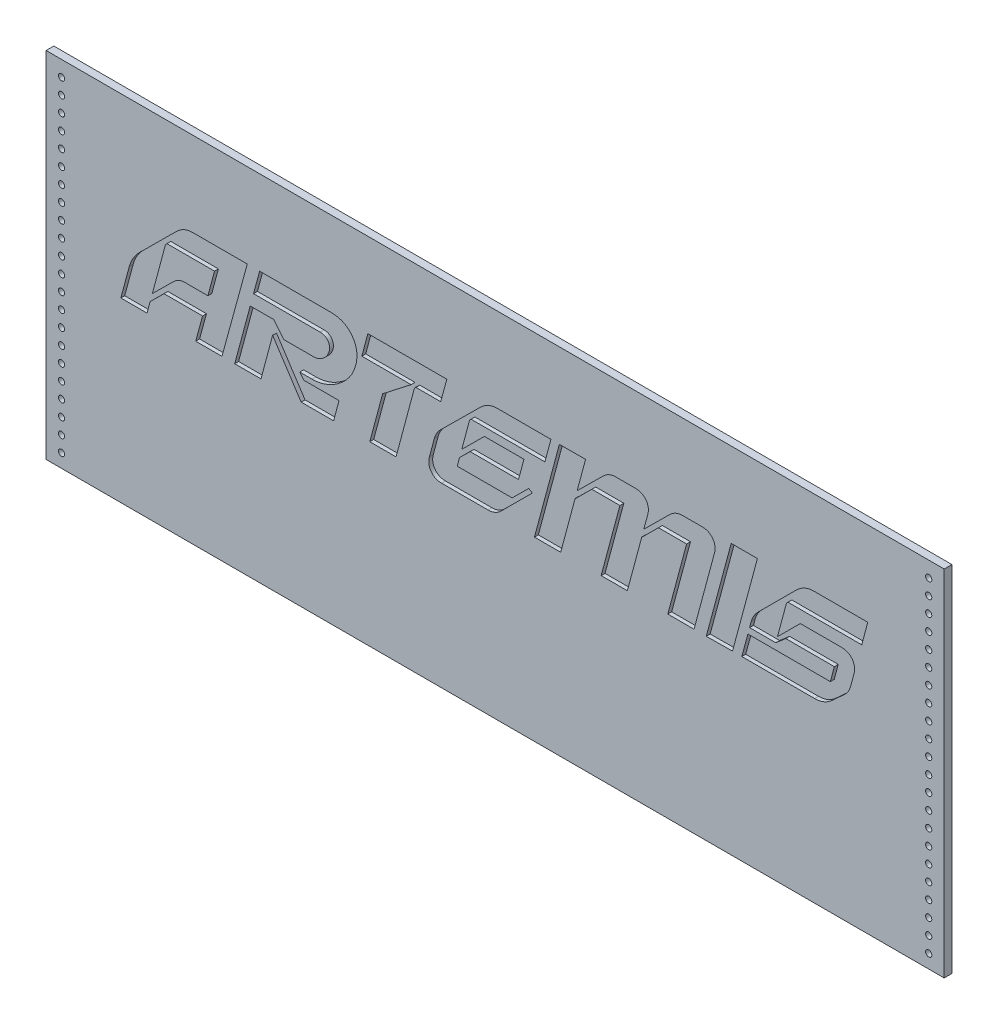
from build123d import *

# Parameters (mm, degrees)
SKETCH1_W           = 736.6
SKETCH1_H           = 290.5125
SKETCH1_R           = 2.54
BOSS_EXTRUDE1_DEPTH = 6.35
CUT_EXTRUDE1_DEPTH  = 3.175


with BuildPart() as part:
    # Sketch1 → Boss-Extrude1 (new body)
    with BuildSketch(Plane.XY):
        with Locations((368.3, -145.25625)):
            Rectangle(SKETCH1_W, SKETCH1_H)
        with Locations((12.7, -12.7)):
            Circle(SKETCH1_R, mode=Mode.SUBTRACT)
        with Locations((12.7, -25.4)):
            Circle(SKETCH1_R, mode=Mode.SUBTRACT)
        with Locations((12.7, -38.1)):
            Circle(SKETCH1_R, mode=Mode.SUBTRACT)
        with Locations((12.7, -50.8)):
            Circle(SKETCH1_R, mode=Mode.SUBTRACT)
        with Locations((12.7, -63.5)):
            Circle(SKETCH1_R, mode=Mode.SUBTRACT)
        with Locations((12.7, -76.2)):
            Circle(SKETCH1_R, mode=Mode.SUBTRACT)
        with Locations((12.7, -88.9)):
            Circle(SKETCH1_R, mode=Mode.SUBTRACT)
        with Locations((12.7, -101.6)):
            Circle(SKETCH1_R, mode=Mode.SUBTRACT)
        with Locations((12.7, -114.3)):
            Circle(SKETCH1_R, mode=Mode.SUBTRACT)
        with Locations((12.7, -127)):
            Circle(SKETCH1_R, mode=Mode.SUBTRACT)
        with Locations((12.7, -139.7)):
            Circle(SKETCH1_R, mode=Mode.SUBTRACT)
        with Locations((12.7, -152.4)):
            Circle(SKETCH1_R, mode=Mode.SUBTRACT)
        with Locations((12.7, -165.1)):
            Circle(SKETCH1_R, mode=Mode.SUBTRACT)
        with Locations((12.7, -177.8)):
            Circle(SKETCH1_R, mode=Mode.SUBTRACT)
        with Locations((12.7, -190.5)):
            Circle(SKETCH1_R, mode=Mode.SUBTRACT)
        with Locations((12.7, -203.2)):
            Circle(SKETCH1_R, mode=Mode.SUBTRACT)
        with Locations((12.7, -215.9)):
            Circle(SKETCH1_R, mode=Mode.SUBTRACT)
        with Locations((12.7, -228.6)):
            Circle(SKETCH1_R, mode=Mode.SUBTRACT)
        with Locations((12.7, -241.3)):
            Circle(SKETCH1_R, mode=Mode.SUBTRACT)
        with Locations((12.7, -254)):
            Circle(SKETCH1_R, mode=Mode.SUBTRACT)
        with Locations((12.7, -266.7)):
            Circle(SKETCH1_R, mode=Mode.SUBTRACT)
        with Locations((12.7, -279.4)):
            Circle(SKETCH1_R, mode=Mode.SUBTRACT)
        with Locations(Location((723.9, -279.4, 0), (0, 0, 180))):
            Circle(SKETCH1_R, mode=Mode.SUBTRACT)
        with Locations(Location((723.9, -266.7, 0), (0, 0, 180))):
            Circle(SKETCH1_R, mode=Mode.SUBTRACT)
        with Locations(Location((723.9, -254, 0), (0, 0, 180))):
            Circle(SKETCH1_R, mode=Mode.SUBTRACT)
        with Locations(Location((723.9, -241.3, 0), (0, 0, 180))):
            Circle(SKETCH1_R, mode=Mode.SUBTRACT)
        with Locations(Location((723.9, -228.6, 0), (0, 0, 180))):
            Circle(SKETCH1_R, mode=Mode.SUBTRACT)
        with Locations(Location((723.9, -215.9, 0), (0, 0, 180))):
            Circle(SKETCH1_R, mode=Mode.SUBTRACT)
        with Locations(Location((723.9, -203.2, 0), (0, 0, 180))):
            Circle(SKETCH1_R, mode=Mode.SUBTRACT)
        with Locations(Location((723.9, -190.5, 0), (0, 0, 180))):
            Circle(SKETCH1_R, mode=Mode.SUBTRACT)
        with Locations(Location((723.9, -177.8, 0), (0, 0, 180))):
            Circle(SKETCH1_R, mode=Mode.SUBTRACT)
        with Locations(Location((723.9, -165.1, 0), (0, 0, 180))):
            Circle(SKETCH1_R, mode=Mode.SUBTRACT)
        with Locations(Location((723.9, -152.4, 0), (0, 0, 180))):
            Circle(SKETCH1_R, mode=Mode.SUBTRACT)
        with Locations(Location((723.9, -139.7, 0), (0, 0, 180))):
            Circle(SKETCH1_R, mode=Mode.SUBTRACT)
        with Locations(Location((723.9, -127, 0), (0, 0, 180))):
            Circle(SKETCH1_R, mode=Mode.SUBTRACT)
        with Locations(Location((723.9, -114.3, 0), (0, 0, 180))):
            Circle(SKETCH1_R, mode=Mode.SUBTRACT)
        with Locations(Location((723.9, -101.6, 0), (0, 0, 180))):
            Circle(SKETCH1_R, mode=Mode.SUBTRACT)
        with Locations(Location((723.9, -88.9, 0), (0, 0, 180))):
            Circle(SKETCH1_R, mode=Mode.SUBTRACT)
        with Locations(Location((723.9, -76.2, 0), (0, 0, 180))):
            Circle(SKETCH1_R, mode=Mode.SUBTRACT)
        with Locations(Location((723.9, -63.5, 0), (0, 0, 180))):
            Circle(SKETCH1_R, mode=Mode.SUBTRACT)
        with Locations(Location((723.9, -12.7, 0), (0, 0, 180))):
            Circle(SKETCH1_R, mode=Mode.SUBTRACT)
        with Locations(Location((723.9, -50.8, 0), (0, 0, 180))):
            Circle(SKETCH1_R, mode=Mode.SUBTRACT)
        with Locations(Location((723.9, -38.1, 0), (0, 0, 180))):
            Circle(SKETCH1_R, mode=Mode.SUBTRACT)
        with Locations(Location((723.9, -25.4, 0), (0, 0, 180))):
            Circle(SKETCH1_R, mode=Mode.SUBTRACT)
    extrude(amount=BOSS_EXTRUDE1_DEPTH)

    # Sketch2 → Cut-Extrude1 (cut)
    # profile 1 of 7: a face of its own
    with BuildSketch(Plane.XY.offset(6.35)):
        with BuildLine():
            Line((120.229287926, -69.166342879), (165.021362229, -69.166342879))
            Line((165.021362229, -69.166342879), (144.245263158, -145.146157121))
            Line((144.245263158, -145.146157121), (122.72996904, -145.146157121))
            Line((122.72996904, -145.146157121), (128.376160991, -124.385785604))
            Line((128.376160991, -124.385785604), (96.748049536, -124.385785604))
            Line((96.748049536, -124.385785604), (85.329845201, -135.693897059))
            Line((85.329845201, -135.693897059), (82.829164087, -145.146157121))
            Line((82.829164087, -145.146157121), (61.313869969, -145.146157121))
            Line((61.313869969, -145.146157121), (68.265448916, -119.274330495))
            add(Edge.make_bspline(
                [(68.265448916, -119.274330495), (68.461100354, -118.610878928), (68.852071182, -117.285101759), (69.59798169, -115.345320629), (70.475641227, -113.455788009), (71.510422768, -111.621854708), (72.67001058, -109.835059102), (73.962116604, -108.096733829), (75.403609552, -106.426434322), (76.438333232, -105.360818922), (76.962786378, -104.820708204)],
                knots=[0, 0, 0, 0, 0.972188851, 1.942727767, 2.918792729, 3.89888478, 4.900660299, 5.911935627, 6.941657613, 8, 8, 8, 8], degree=3))
            Line((76.962786378, -104.820708204), (106.970959752, -75.032720588))
            add(Edge.make_bspline(
                [(106.970959752, -75.032720588), (107.466803378, -74.56813401), (108.440314808, -73.655990905), (110.001420258, -72.456655807), (111.612321524, -71.449538548), (113.249880792, -70.607099676), (114.934812873, -69.951060561), (116.66606764, -69.499007643), (118.438054038, -69.224073414), (119.630680637, -69.18563568), (120.229287926, -69.166342879)],
                knots=[0, 0, 0, 0, 1.09520327, 2.15026038, 3.168190723, 4.15492977, 5.115689715, 6.0773418, 7.034972711, 8, 8, 8, 8], degree=3))
        make_face()
        with BuildLine():
            Line((132.732693498, -107.856126161), (138.15869969, -87.64621904))
            Line((138.15869969, -87.64621904), (99.138637771, -87.64621904))
            Line((99.138637771, -87.64621904), (97.943343653, -88.841513158))
            Line((97.943343653, -88.841513158), (87.185696594, -129.056869195))
            Line((87.185696594, -129.056869195), (104.674736842, -111.772287152))
            add(Edge.make_bspline(
                [(104.674736842, -111.772287152), (105.000195637, -111.462765672), (105.639660696, -110.854614426), (106.663932834, -110.051783427), (107.723480529, -109.363953717), (108.820266814, -108.823172411), (109.937635202, -108.381250719), (111.091008635, -108.092401093), (112.274590742, -107.890265608), (113.077630676, -107.867562831), (113.482167183, -107.856126161)],
                knots=[0, 0, 0, 0, 1.088018936, 2.137751703, 3.149265309, 4.143636785, 5.096896491, 6.055307392, 7.020348651, 8, 8, 8, 8], degree=3))
            Line((113.482167183, -107.856126161), (132.732693498, -107.856126161))
        make_face(mode=Mode.SUBTRACT)
    # profile 2 of 7: a face of its own
    with BuildSketch(Plane.XY.offset(6.35)):
        with BuildLine():
            add(Edge.make_bspline(
                [(251.035356037, -77.203123065), (251.504553544, -77.889369004), (252.434826048, -79.24998094), (253.501830124, -81.477382225), (254.292641631, -83.800537603), (254.805398026, -86.234442869), (254.998989864, -88.780923777), (254.913954561, -91.431565736), (254.551770612, -94.193275248), (254.099401555, -96.037921567), (253.866315789, -96.988386223)],
                knots=[0, 0, 0, 0, 0.961877665, 1.907103789, 2.850083582, 3.799378563, 4.780335239, 5.801073342, 6.866990356, 8, 8, 8, 8], degree=3))
            add(Edge.make_bspline(
                [(253.866315789, -96.988386223), (253.58508411, -97.927732843), (253.024673091, -99.799571024), (251.869069503, -102.498422697), (250.509338426, -105.100098448), (248.884082926, -107.575807837), (247.060802723, -109.962432459), (244.983517285, -112.230341101), (242.691255388, -114.401909657), (240.187806353, -116.420237691), (237.576591529, -118.286310474), (234.88023908, -119.897413498), (232.172528124, -121.307979388), (229.409932111, -122.410870314), (226.636022635, -123.31439008), (223.815267915, -123.916446872), (220.970390421, -124.314148815), (219.05732106, -124.361924509), (218.101857585, -124.385785604)],
                knots=[0, 0, 0, 0, 0.97804993, 1.948962355, 2.925064492, 3.904792855, 4.901205012, 5.919903121, 6.971183752, 8.049975335, 9.127306388, 10.171923768, 11.182945394, 12.171203276, 13.137691742, 14.09124472, 15.046691149, 16, 16, 16, 16], degree=3))
            Line((218.101857585, -124.385785604), (208.099133127, -124.385785604))
            Line((208.099133127, -124.385785604), (211.354736842, -128.522132353))
            Line((211.354736842, -128.522132353), (240.277708978, -128.522132353))
            Line((240.277708978, -128.522132353), (235.826811146, -145.146157121))
            Line((235.826811146, -145.146157121), (209.184334365, -145.146157121))
            Line((209.184334365, -145.146157121), (185.813188854, -109.381698916))
            Line((185.813188854, -109.381698916), (176.250835913, -145.146157121))
            Line((176.250835913, -145.146157121), (154.719814241, -145.146157121))
            Line((154.719814241, -145.146157121), (167.443405573, -97.743308824))
            Line((167.443405573, -97.743308824), (186.678204334, -97.743308824))
            Line((186.678204334, -97.743308824), (195.060990712, -107.856126161))
            Line((195.060990712, -107.856126161), (219.407244582, -107.856126161))
            add(Edge.make_bspline(
                [(219.407244582, -107.856126161), (220.092741223, -107.819855605), (221.471353922, -107.746911338), (223.493076466, -107.14488001), (225.459410912, -106.196514933), (227.325032189, -104.904871893), (229.006430412, -103.363723042), (230.428358952, -101.652720328), (231.472888699, -99.770709654), (232.178113414, -97.799094733), (232.540255125, -95.824322378), (232.488383287, -93.928563527), (232.021368508, -92.168707964), (231.154153835, -90.600616117), (229.956681639, -89.282981438), (228.460715689, -88.296349774), (226.673214959, -87.746467936), (225.403143357, -87.680644985), (224.738885449, -87.64621904)],
                knots=[0, 0, 0, 0, 1.024328987, 2.060043575, 3.13039622, 4.281662315, 5.442274921, 6.535335147, 7.596155383, 8.645921005, 9.657215708, 10.583586998, 11.460982792, 12.356435318, 13.239426359, 14.101212219, 15.006918353, 16, 16, 16, 16], degree=3))
            Line((224.738885449, -87.64621904), (170.164272446, -87.64621904))
            Line((170.164272446, -87.64621904), (175.165634675, -69.166342879))
            Line((175.165634675, -69.166342879), (233.640681115, -69.166342879))
            add(Edge.make_bspline(
                [(233.640681115, -69.166342879), (234.564743819, -69.188954577), (236.363328636, -69.232965721), (238.97851593, -69.61974103), (241.428064964, -70.24312916), (243.709356564, -71.121454719), (245.804638789, -72.271856738), (247.743865443, -73.650798748), (249.522996478, -75.285531431), (250.527589824, -76.559302463), (251.035356037, -77.203123065)],
                knots=[0, 0, 0, 0, 1.112653996, 2.165656695, 3.176610271, 4.152371772, 5.101949124, 6.048265736, 7.013506589, 8, 8, 8, 8], degree=3))
        make_face()
    # profile 3 of 7: a face of its own
    with BuildSketch(Plane.XY.offset(6.35)):
        Polygon((328.666563467, -69.166342879), (323.665201238, -87.64621904), (303.345201238, -87.64621904), (302.149907121, -88.621327399), (287.035727554, -145.146157121), (265.504705882, -145.146157121), (276.057894737, -105.795816563), (299.429040248, -87.64621904), (258.993498452, -87.64621904), (263.884767802, -69.166342879), align=None)
    # profile 4 of 7: a face of its own
    with BuildSketch(Plane.XY.offset(6.35)):
        with BuildLine():
            Line((348.54619195, -87.64621904), (347.350897833, -88.841513158))
            Line((347.350897833, -88.841513158), (340.934055728, -112.85748839))
            Line((340.934055728, -112.85748839), (359.524024768, -94.377612229))
            Line((359.524024768, -94.377612229), (391.922786378, -94.377612229))
            Line((391.922786378, -94.377612229), (387.471888545, -111.017364551))
            Line((387.471888545, -111.017364551), (347.79126935, -111.017364551))
            Line((347.79126935, -111.017364551), (339.093931889, -119.604609133))
            Line((339.093931889, -119.604609133), (337.238080495, -126.66628096))
            Line((337.238080495, -126.66628096), (382.250340557, -126.66628096))
            Line((382.250340557, -126.66628096), (395.838947368, -113.187767028))
            Line((395.838947368, -113.187767028), (398.874365325, -114.933525542))
            Line((398.874365325, -114.933525542), (373.222724458, -140.475073529))
            add(Edge.make_bspline(
                [(373.222724458, -140.475073529), (372.826393924, -140.85061221), (372.049205149, -141.587028968), (370.779434862, -142.52641142), (369.487248212, -143.334242315), (368.160352128, -144.006919822), (366.784913483, -144.506556468), (365.378980913, -144.870042336), (363.935166559, -145.099053993), (362.958711962, -145.130340575), (362.465077399, -145.146157121)],
                knots=[0, 0, 0, 0, 1.087710149, 2.132957327, 3.142311131, 4.123953504, 5.092881289, 6.053713067, 7.016078678, 8, 8, 8, 8], degree=3))
            Line((362.465077399, -145.146157121), (324.420123839, -145.146157121))
            add(Edge.make_bspline(
                [(324.420123839, -145.146157121), (323.963338012, -145.134754303), (323.07189189, -145.112500991), (321.774709488, -144.919352295), (320.560107376, -144.608809221), (319.431548928, -144.169735327), (318.401890428, -143.586906927), (317.428466148, -142.918718505), (316.562857728, -142.088982743), (315.796129335, -141.14613088), (315.138148022, -140.118025728), (314.620270681, -139.021391022), (314.213492088, -137.886948543), (313.98727681, -136.688207566), (313.872267963, -135.444645921), (313.910001446, -134.147415919), (314.080650285, -132.802809865), (314.30323724, -131.9069388), (314.417399381, -131.44745743)],
                knots=[0, 0, 0, 0, 1.094945795, 2.136855229, 3.137044923, 4.096584279, 5.030749513, 5.969051044, 6.920650617, 7.894578144, 8.878114772, 9.839711021, 10.797931648, 11.759527897, 12.756631189, 13.787866602, 14.865423694, 16, 16, 16, 16], degree=3))
            Line((314.417399381, -131.44745743), (318.443653251, -116.333277864))
            add(Edge.make_bspline(
                [(318.443653251, -116.333277864), (318.705387975, -115.494000989), (319.230237782, -113.811020991), (320.508922164, -111.466495791), (322.038015238, -109.205411379), (323.323521885, -107.885228523), (323.979752322, -107.21129644)],
                knots=[0, 0, 0, 0, 0.975136166, 1.955415087, 2.956272335, 4, 4, 4, 4], degree=3))
            Line((323.979752322, -107.21129644), (356.048235294, -75.457364551))
            add(Edge.make_bspline(
                [(356.048235294, -75.457364551), (356.574418635, -74.954786088), (357.600661796, -73.974580766), (359.253428409, -72.697225363), (360.937801832, -71.593432565), (362.687283935, -70.724948285), (364.464179458, -70.008900082), (366.298857102, -69.532242006), (368.173670631, -69.215752669), (369.441577524, -69.182841927), (370.077213622, -69.166342879)],
                knots=[0, 0, 0, 0, 1.104987577, 2.155115633, 3.169368792, 4.159784375, 5.118388166, 6.074904324, 7.034897349, 8, 8, 8, 8], degree=3))
            Line((370.077213622, -69.166342879), (414.098637771, -69.166342879))
            Line((414.098637771, -69.166342879), (409.097275542, -87.64621904))
            Line((409.097275542, -87.64621904), (348.54619195, -87.64621904))
        make_face()
    # profile 5 of 7: a face of its own
    with BuildSketch(Plane.XY.offset(6.35)):
        with BuildLine():
            add(Edge.make_bspline(
                [(538.173312693, -69.276435759), (538.630068883, -69.287976664), (539.521457166, -69.310499464), (540.81402054, -69.500986058), (542.022405318, -69.816295491), (543.144943733, -70.254356291), (544.179449232, -70.828647977), (545.129608591, -71.527049859), (546.0006147, -72.347310855), (546.762012309, -73.2900516), (547.423179291, -74.311522025), (547.966435679, -75.393698387), (548.337707824, -76.541656314), (548.59599854, -77.72639809), (548.705256927, -78.968057097), (548.662851289, -80.258029192), (548.518166588, -81.605411651), (548.292076737, -82.500174793), (548.176037152, -82.959407895)],
                knots=[0, 0, 0, 0, 1.097393907, 2.141632874, 3.131868155, 4.093552878, 5.029806748, 5.967331608, 6.921058796, 7.897163859, 8.872292491, 9.841541882, 10.79784593, 11.764142286, 12.750924321, 13.784465402, 14.862886974, 16, 16, 16, 16], degree=3))
            Line((548.176037152, -82.959407895), (531.42619195, -145.366342879))
            Line((531.42619195, -145.366342879), (509.910897833, -145.366342879))
            Line((509.910897833, -145.366342879), (525.339628483, -87.850677245))
            Line((525.339628483, -87.850677245), (502.29876161, -87.850677245))
            Line((502.29876161, -87.850677245), (488.710154799, -101.344918731))
            Line((488.710154799, -101.344918731), (488.60006192, -101.234825851))
            Line((488.60006192, -101.234825851), (476.741486068, -145.366342879))
            Line((476.741486068, -145.366342879), (455.22619195, -145.366342879))
            Line((455.22619195, -145.366342879), (470.654922601, -87.850677245))
            Line((470.654922601, -87.850677245), (447.614055728, -87.850677245))
            Line((447.614055728, -87.850677245), (434.025448916, -101.344918731))
            Line((434.025448916, -101.344918731), (433.915356037, -101.234825851))
            Line((433.915356037, -101.234825851), (422.07250774, -145.366342879))
            Line((422.07250774, -145.366342879), (400.541486068, -145.366342879))
            Line((400.541486068, -145.366342879), (420.987306502, -69.276435759))
            Line((420.987306502, -69.276435759), (442.502600619, -69.166342879))
            Line((442.502600619, -69.166342879), (435.551021672, -94.928076625))
            Line((435.551021672, -94.928076625), (456.641671827, -74.057612229))
            add(Edge.make_bspline(
                [(456.641671827, -74.057612229), (457.039611985, -73.679061013), (457.819102977, -72.937549365), (459.064743635, -71.952488741), (460.359267582, -71.142045664), (461.670855436, -70.446474168), (463.031788145, -69.933584607), (464.419918359, -69.548476208), (465.845600052, -69.325494474), (466.806176451, -69.292851223), (467.289226006, -69.276435759)],
                knots=[0, 0, 0, 0, 1.099200487, 2.15312996, 3.172151549, 4.153175518, 5.119892887, 6.077164679, 7.033054793, 8, 8, 8, 8], degree=3))
            Line((467.289226006, -69.276435759), (483.378513932, -69.276435759))
            add(Edge.make_bspline(
                [(483.378513932, -69.276435759), (483.845774533, -69.287737539), (484.752881776, -69.309678031), (486.066074252, -69.501304943), (487.290724575, -69.815378851), (488.430869179, -70.25914846), (489.489317864, -70.819318285), (490.445183929, -71.527413362), (491.315081905, -72.352134897), (492.094502308, -73.284578365), (492.75332401, -74.31222908), (493.297710416, -75.393515053), (493.66857924, -76.541695539), (493.927374694, -77.726426012), (494.034958934, -78.967898489), (493.999114454, -80.259321484), (493.82797623, -81.604090038), (493.605458107, -82.499938247), (493.491331269, -82.959407895)],
                knots=[0, 0, 0, 0, 1.116063891, 2.166648842, 3.163266127, 4.131043077, 5.083866772, 6.015959045, 6.964159759, 7.942580802, 8.912058948, 9.87569192, 10.826454562, 11.787151611, 12.768215633, 13.79576775, 14.869476096, 16, 16, 16, 16], degree=3))
            Line((493.491331269, -82.959407895), (490.235727554, -94.928076625))
            Line((490.235727554, -94.928076625), (511.310650155, -74.057612229))
            add(Edge.make_bspline(
                [(511.310650155, -74.057612229), (511.707721618, -73.677881447), (512.488500457, -72.931200343), (513.746569673, -71.963403585), (515.032723713, -71.131885611), (516.353011796, -70.451418552), (517.716016363, -69.932719984), (519.104750837, -69.54870536), (520.530273877, -69.325436447), (521.490871607, -69.292831807), (521.973931889, -69.276435759)],
                knots=[0, 0, 0, 0, 1.097998373, 2.15904182, 3.168111355, 4.157382506, 5.123042648, 6.079267542, 7.034112269, 8, 8, 8, 8], degree=3))
            Line((521.973931889, -69.276435759), (538.173312693, -69.276435759))
        make_face()
    # profile 6 of 7: a face of its own
    with BuildSketch(Plane.XY.offset(6.35)):
        Polygon((561.90619195, -69.166342879), (583.421486068, -69.166342879), (562.991393189, -145.146157121), (541.460371517, -145.366342879), align=None)
    # profile 7 of 7: a face of its own
    with BuildSketch(Plane.XY.offset(6.35)):
        with BuildLine():
            Line((608.459752322, -87.64621904), (607.264458204, -88.841513158))
            Line((607.264458204, -88.841513158), (599.87250774, -116.443370743))
            Line((599.87250774, -116.443370743), (618.572569659, -97.743308824))
            Line((618.572569659, -97.743308824), (652.481176471, -97.743308824))
            add(Edge.make_bspline(
                [(652.481176471, -97.743308824), (652.94846139, -97.754483925), (653.855615843, -97.77617849), (655.173510166, -97.970278908), (656.404114819, -98.280210818), (657.546819859, -98.721258812), (658.59637959, -99.29580389), (659.561980239, -99.988791835), (660.433210765, -100.81517737), (661.201072418, -101.758621326), (661.852182356, -102.791930786), (662.400644574, -103.875888214), (662.773502251, -105.029071403), (663.031080889, -106.230092356), (663.137064488, -107.492495252), (663.102226151, -108.80481737), (662.929069773, -110.170073281), (662.707949704, -111.082087818), (662.593993808, -111.552101393)],
                knots=[0, 0, 0, 0, 1.109102603, 2.153134682, 3.15559003, 4.117330611, 5.053263289, 5.989609858, 6.931896307, 7.89629219, 8.870203132, 9.827825582, 10.772657979, 11.739541594, 12.739287703, 13.772876215, 14.852234947, 16, 16, 16, 16], degree=3))
            Line((662.593993808, -111.552101393), (659.873126935, -121.664918731))
            add(Edge.make_bspline(
                [(659.873126935, -121.664918731), (659.6205718, -122.482272045), (659.114150976, -124.121220062), (657.885065473, -126.420528917), (656.299702448, -128.57316784), (655.001414329, -129.829455789), (654.337027864, -130.472349071)],
                knots=[0, 0, 0, 0, 0.971370715, 1.947782042, 2.949797186, 4, 4, 4, 4], degree=3))
            Line((654.337027864, -130.472349071), (644.774674923, -139.169686533))
            add(Edge.make_bspline(
                [(644.774674923, -139.169686533), (644.23260596, -139.646817464), (643.168182034, -140.583727), (641.455357565, -141.785405078), (639.729463271, -142.844944598), (637.937973678, -143.668554623), (636.125244693, -144.350082485), (634.253545972, -144.793458804), (632.349116578, -145.0936368), (631.061408793, -145.128611653), (630.415417957, -145.146157121)],
                knots=[0, 0, 0, 0, 1.087244962, 2.13494893, 3.148231978, 4.134112956, 5.101176401, 6.060986606, 7.027275522, 8, 8, 8, 8], degree=3))
            Line((630.415417957, -145.146157121), (570.63498452, -145.146157121))
            Line((570.63498452, -145.146157121), (575.636346749, -126.66628096))
            Line((575.636346749, -126.66628096), (643.249102167, -126.66628096))
            Line((643.249102167, -126.66628096), (646.504705882, -114.383061146))
            Line((646.504705882, -114.383061146), (606.713993808, -114.383061146))
            Line((606.713993808, -114.383061146), (598.457027864, -121.444732972))
            Line((598.457027864, -121.444732972), (577.036099071, -121.444732972))
            Line((577.036099071, -121.444732972), (578.341486068, -116.333277864))
            add(Edge.make_bspline(
                [(578.341486068, -116.333277864), (578.609610586, -115.473807952), (579.148479696, -113.746469508), (580.432492965, -111.315916925), (582.024251613, -108.984155167), (583.333204223, -107.593203679), (584.003405573, -106.881017802)],
                knots=[0, 0, 0, 0, 0.968000833, 1.945460836, 2.948048303, 4, 4, 4, 4], degree=3))
            Line((584.003405573, -106.881017802), (615.206873065, -75.67755031))
            add(Edge.make_bspline(
                [(615.206873065, -75.67755031), (615.747818154, -75.158169943), (616.8095166, -74.138796), (618.531515433, -72.825048779), (620.290649389, -71.693544162), (622.100762467, -70.753764338), (623.978403988, -70.049241946), (625.902133363, -69.545287991), (627.871634863, -69.211485574), (629.208286763, -69.181451388), (629.880681115, -69.166342879)],
                knots=[0, 0, 0, 0, 1.090484129, 2.140264008, 3.14544098, 4.131445471, 5.1019832, 6.056773183, 7.022471944, 8, 8, 8, 8], degree=3))
            Line((629.880681115, -69.166342879), (673.902105263, -69.166342879))
            Line((673.902105263, -69.166342879), (669.010835913, -87.64621904))
            Line((669.010835913, -87.64621904), (608.459752322, -87.64621904))
        make_face()
    extrude(amount=-CUT_EXTRUDE1_DEPTH, mode=Mode.SUBTRACT)


solid = part.part
